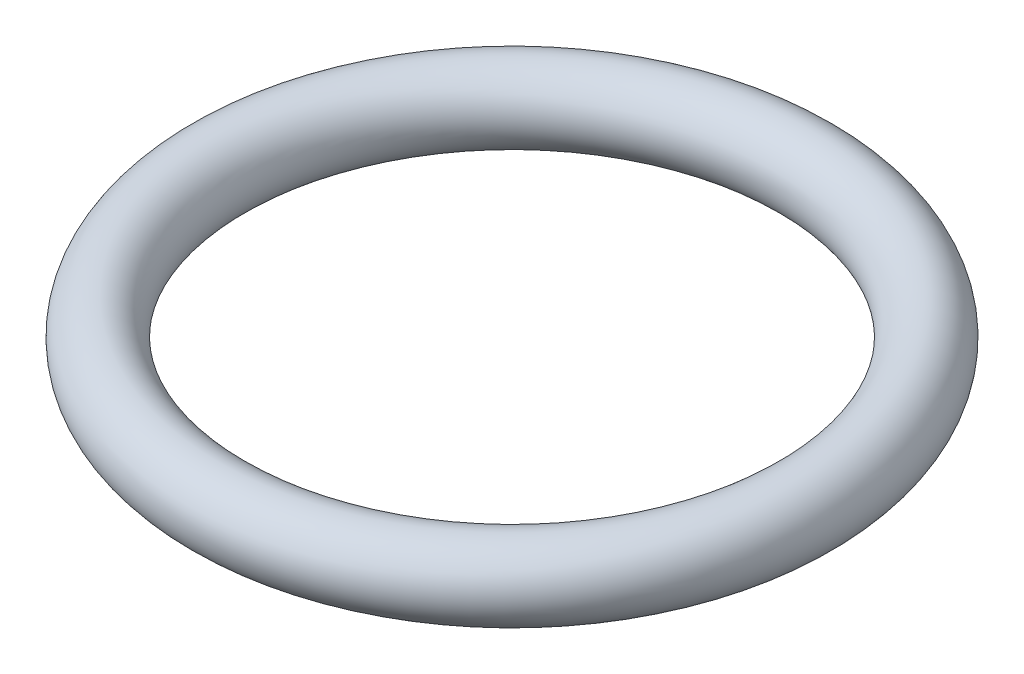
from build123d import *

# Parameters (mm, degrees)
SKETCH1_R = 1.25


with BuildPart() as part:
    # Sketch1 → Revolve1 (revolve)
    with BuildSketch(Plane.XY):
        with Locations((-10, 0)):
            Circle(SKETCH1_R)
    revolve(axis=Axis((0, 14.080317926, 0), (0, -1, 0)))


solid = part.part
